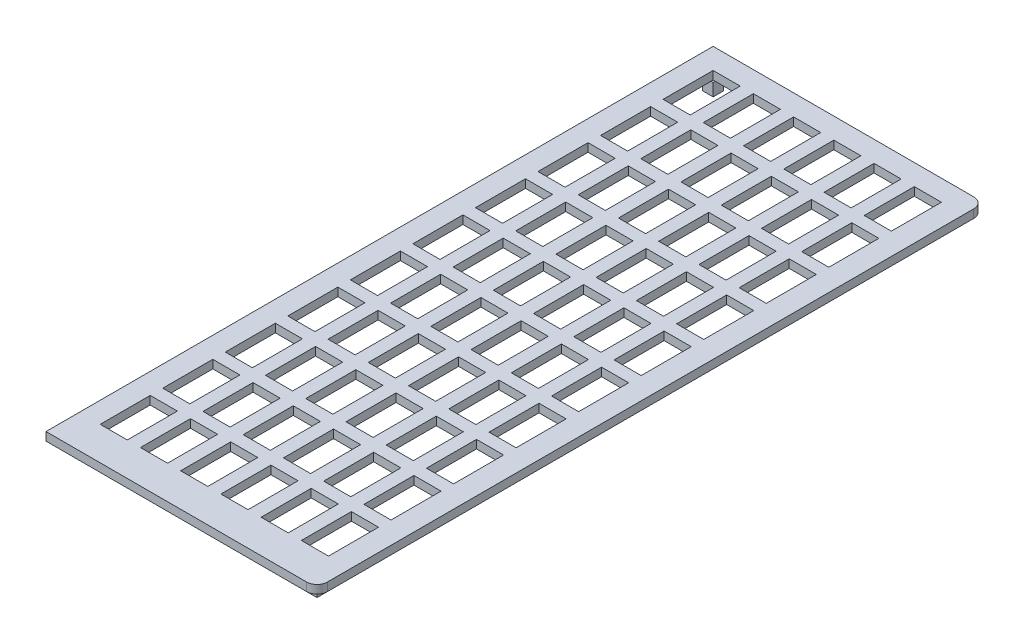
from build123d import *

# Parameters (mm, degrees)
SKETCH1_W           = 13
SKETCH1_H           = 24
BOSS_EXTRUDE1_DEPTH = 4
SKETCH2_W           = 5
SKETCH2_H           = 5
BOSS_EXTRUDE2_DEPTH = 6


with BuildPart() as part:
    # Sketch1 → Boss-Extrude1 (new body)
    with BuildSketch(Plane(origin=(0, 0, 0), x_dir=(1, 0, 0), z_dir=(0, 1, 0))):
        with BuildLine():
            Line((-308.629441624, 40.609137056), (-183.629441624, 40.609137056))
            ThreePointArc((-183.629441624, 40.609137056), (-180.093907718, 39.144670962), (-178.629441624, 35.609137056))
            Line((-178.629441624, 35.609137056), (-178.629441624, -274.390862944))
            ThreePointArc((-178.629441624, -274.390862944), (-180.093907718, -277.92639685), (-183.629441624, -279.390862944))
            Line((-183.629441624, -279.390862944), (-308.629441624, -279.390862944))
            Line((-308.629441624, -279.390862944), (-308.629441624, 40.609137056))
        make_face()
        with Locations((-292.129441624, 18.609137056)):
            Rectangle(SKETCH1_W, SKETCH1_H, mode=Mode.SUBTRACT)
        with Locations((-272.829441624, 18.609137056)):
            Rectangle(SKETCH1_W, SKETCH1_H, mode=Mode.SUBTRACT)
        with Locations((-253.529441624, 18.609137056)):
            Rectangle(SKETCH1_W, SKETCH1_H, mode=Mode.SUBTRACT)
        with Locations((-234.229441624, 18.609137056)):
            Rectangle(SKETCH1_W, SKETCH1_H, mode=Mode.SUBTRACT)
        with Locations((-214.929441624, 18.609137056)):
            Rectangle(SKETCH1_W, SKETCH1_H, mode=Mode.SUBTRACT)
        with Locations((-195.629441624, 18.609137056)):
            Rectangle(SKETCH1_W, SKETCH1_H, mode=Mode.SUBTRACT)
        with Locations((-272.829441624, -11.390862944)):
            Rectangle(SKETCH1_W, SKETCH1_H, mode=Mode.SUBTRACT)
        with Locations((-253.529441624, -11.390862944)):
            Rectangle(SKETCH1_W, SKETCH1_H, mode=Mode.SUBTRACT)
        with Locations((-234.229441624, -11.390862944)):
            Rectangle(SKETCH1_W, SKETCH1_H, mode=Mode.SUBTRACT)
        with Locations((-214.929441624, -11.390862944)):
            Rectangle(SKETCH1_W, SKETCH1_H, mode=Mode.SUBTRACT)
        with Locations((-195.629441624, -11.390862944)):
            Rectangle(SKETCH1_W, SKETCH1_H, mode=Mode.SUBTRACT)
        with Locations((-272.829441624, -41.390862944)):
            Rectangle(SKETCH1_W, SKETCH1_H, mode=Mode.SUBTRACT)
        with Locations((-253.529441624, -41.390862944)):
            Rectangle(SKETCH1_W, SKETCH1_H, mode=Mode.SUBTRACT)
        with Locations((-234.229441624, -41.390862944)):
            Rectangle(SKETCH1_W, SKETCH1_H, mode=Mode.SUBTRACT)
        with Locations((-214.929441624, -41.390862944)):
            Rectangle(SKETCH1_W, SKETCH1_H, mode=Mode.SUBTRACT)
        with Locations((-195.629441624, -41.390862944)):
            Rectangle(SKETCH1_W, SKETCH1_H, mode=Mode.SUBTRACT)
        with Locations((-272.829441624, -71.390862944)):
            Rectangle(SKETCH1_W, SKETCH1_H, mode=Mode.SUBTRACT)
        with Locations((-253.529441624, -71.390862944)):
            Rectangle(SKETCH1_W, SKETCH1_H, mode=Mode.SUBTRACT)
        with Locations((-234.229441624, -71.390862944)):
            Rectangle(SKETCH1_W, SKETCH1_H, mode=Mode.SUBTRACT)
        with Locations((-214.929441624, -71.390862944)):
            Rectangle(SKETCH1_W, SKETCH1_H, mode=Mode.SUBTRACT)
        with Locations((-195.629441624, -71.390862944)):
            Rectangle(SKETCH1_W, SKETCH1_H, mode=Mode.SUBTRACT)
        with Locations((-272.829441624, -101.390862944)):
            Rectangle(SKETCH1_W, SKETCH1_H, mode=Mode.SUBTRACT)
        with Locations((-253.529441624, -101.390862944)):
            Rectangle(SKETCH1_W, SKETCH1_H, mode=Mode.SUBTRACT)
        with Locations((-234.229441624, -101.390862944)):
            Rectangle(SKETCH1_W, SKETCH1_H, mode=Mode.SUBTRACT)
        with Locations((-214.929441624, -101.390862944)):
            Rectangle(SKETCH1_W, SKETCH1_H, mode=Mode.SUBTRACT)
        with Locations((-195.629441624, -101.390862944)):
            Rectangle(SKETCH1_W, SKETCH1_H, mode=Mode.SUBTRACT)
        with Locations((-272.829441624, -131.390862944)):
            Rectangle(SKETCH1_W, SKETCH1_H, mode=Mode.SUBTRACT)
        with Locations((-253.529441624, -131.390862944)):
            Rectangle(SKETCH1_W, SKETCH1_H, mode=Mode.SUBTRACT)
        with Locations((-234.229441624, -131.390862944)):
            Rectangle(SKETCH1_W, SKETCH1_H, mode=Mode.SUBTRACT)
        with Locations((-214.929441624, -131.390862944)):
            Rectangle(SKETCH1_W, SKETCH1_H, mode=Mode.SUBTRACT)
        with Locations((-195.629441624, -131.390862944)):
            Rectangle(SKETCH1_W, SKETCH1_H, mode=Mode.SUBTRACT)
        with Locations((-272.829441624, -161.390862944)):
            Rectangle(SKETCH1_W, SKETCH1_H, mode=Mode.SUBTRACT)
        with Locations((-253.529441624, -161.390862944)):
            Rectangle(SKETCH1_W, SKETCH1_H, mode=Mode.SUBTRACT)
        with Locations((-234.229441624, -161.390862944)):
            Rectangle(SKETCH1_W, SKETCH1_H, mode=Mode.SUBTRACT)
        with Locations((-214.929441624, -161.390862944)):
            Rectangle(SKETCH1_W, SKETCH1_H, mode=Mode.SUBTRACT)
        with Locations((-195.629441624, -161.390862944)):
            Rectangle(SKETCH1_W, SKETCH1_H, mode=Mode.SUBTRACT)
        with Locations((-272.829441624, -191.390862944)):
            Rectangle(SKETCH1_W, SKETCH1_H, mode=Mode.SUBTRACT)
        with Locations((-253.529441624, -191.390862944)):
            Rectangle(SKETCH1_W, SKETCH1_H, mode=Mode.SUBTRACT)
        with Locations((-234.229441624, -191.390862944)):
            Rectangle(SKETCH1_W, SKETCH1_H, mode=Mode.SUBTRACT)
        with Locations((-214.929441624, -191.390862944)):
            Rectangle(SKETCH1_W, SKETCH1_H, mode=Mode.SUBTRACT)
        with Locations((-195.629441624, -191.390862944)):
            Rectangle(SKETCH1_W, SKETCH1_H, mode=Mode.SUBTRACT)
        with Locations((-272.829441624, -221.390862944)):
            Rectangle(SKETCH1_W, SKETCH1_H, mode=Mode.SUBTRACT)
        with Locations((-253.529441624, -221.390862944)):
            Rectangle(SKETCH1_W, SKETCH1_H, mode=Mode.SUBTRACT)
        with Locations((-234.229441624, -221.390862944)):
            Rectangle(SKETCH1_W, SKETCH1_H, mode=Mode.SUBTRACT)
        with Locations((-214.929441624, -221.390862944)):
            Rectangle(SKETCH1_W, SKETCH1_H, mode=Mode.SUBTRACT)
        with Locations((-195.629441624, -221.390862944)):
            Rectangle(SKETCH1_W, SKETCH1_H, mode=Mode.SUBTRACT)
        with Locations((-272.829441624, -251.390862944)):
            Rectangle(SKETCH1_W, SKETCH1_H, mode=Mode.SUBTRACT)
        with Locations((-253.529441624, -251.390862944)):
            Rectangle(SKETCH1_W, SKETCH1_H, mode=Mode.SUBTRACT)
        with Locations((-234.229441624, -251.390862944)):
            Rectangle(SKETCH1_W, SKETCH1_H, mode=Mode.SUBTRACT)
        with Locations((-214.929441624, -251.390862944)):
            Rectangle(SKETCH1_W, SKETCH1_H, mode=Mode.SUBTRACT)
        with Locations((-195.629441624, -251.390862944)):
            Rectangle(SKETCH1_W, SKETCH1_H, mode=Mode.SUBTRACT)
        with Locations((-292.129441624, -11.390862944)):
            Rectangle(SKETCH1_W, SKETCH1_H, mode=Mode.SUBTRACT)
        with Locations((-292.129441624, -41.390862944)):
            Rectangle(SKETCH1_W, SKETCH1_H, mode=Mode.SUBTRACT)
        with Locations((-292.129441624, -71.390862944)):
            Rectangle(SKETCH1_W, SKETCH1_H, mode=Mode.SUBTRACT)
        with Locations((-292.129441624, -101.390862944)):
            Rectangle(SKETCH1_W, SKETCH1_H, mode=Mode.SUBTRACT)
        with Locations((-292.129441624, -131.390862944)):
            Rectangle(SKETCH1_W, SKETCH1_H, mode=Mode.SUBTRACT)
        with Locations((-292.129441624, -161.390862944)):
            Rectangle(SKETCH1_W, SKETCH1_H, mode=Mode.SUBTRACT)
        with Locations((-292.129441624, -191.390862944)):
            Rectangle(SKETCH1_W, SKETCH1_H, mode=Mode.SUBTRACT)
        with Locations((-292.129441624, -221.390862944)):
            Rectangle(SKETCH1_W, SKETCH1_H, mode=Mode.SUBTRACT)
        with Locations((-292.129441624, -251.390862944)):
            Rectangle(SKETCH1_W, SKETCH1_H, mode=Mode.SUBTRACT)
    extrude(amount=BOSS_EXTRUDE1_DEPTH)

    # Sketch2 → Boss-Extrude2 (add)
    with BuildSketch(Plane.XZ):
        with Locations((-187.129441624, 270.890862944)):
            Rectangle(SKETCH2_W, SKETCH2_H)
        with Locations((-300.129441624, 270.890862944)):
            Rectangle(SKETCH2_W, SKETCH2_H)
        with Locations((-300.129441624, -32.109137056)):
            Rectangle(SKETCH2_W, SKETCH2_H)
    extrude(amount=BOSS_EXTRUDE2_DEPTH)


solid = part.part
